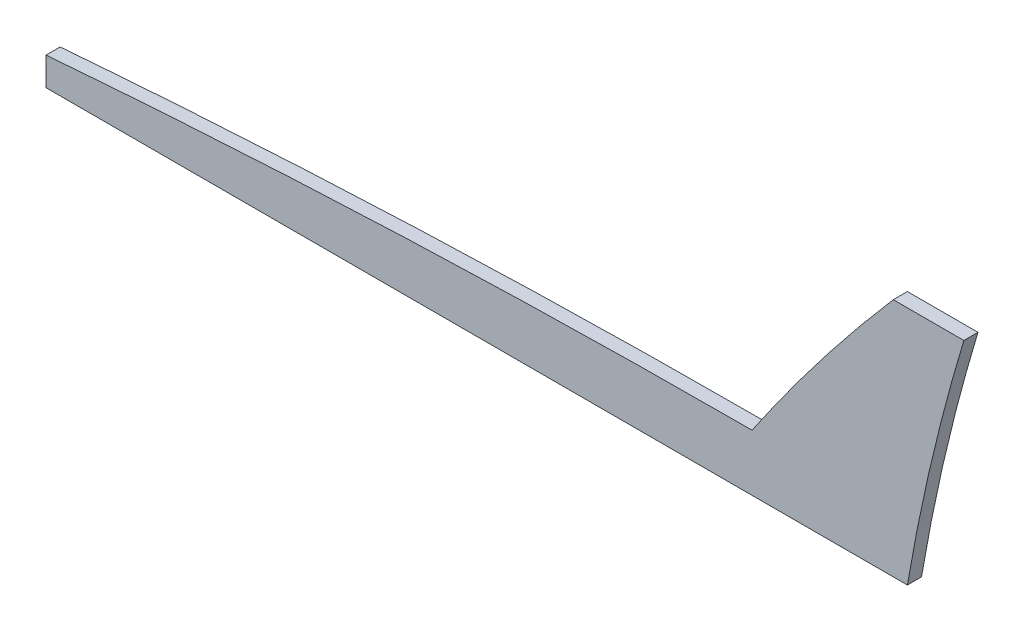
from build123d import *

# Parameters (mm, degrees)
BOSS_EXTRUDE1_DEPTH = 10


with BuildPart() as part:
    # Sketch1 → Boss-Extrude1 (new body)
    with BuildSketch(Plane.XY):
        with BuildLine():
            Line((0, 0), (0, -20))
            Line((0, -20), (610, -20))
            add(Edge.make_bspline(
                [(610, -20), (624.457520828, 65.560799572), (650, 150)],
                knots=[0, 0, 0, 1, 1, 1], degree=2))
            Line((650, 150), (600, 150))
            add(Edge.make_bspline(
                [(600, 150), (544.925349806, 86.324000125), (500, 20.000000001)],
                knots=[0, 0, 0, 1, 1, 1], degree=2))
            add(Edge.make_bspline(
                [(0, 0), (250, 20), (500, 20.000000001)],
                knots=[0.083156312, 0.083156312, 0.083156312, 0.916650574, 0.916650574, 0.916650574], degree=2))
        make_face()
    extrude(amount=BOSS_EXTRUDE1_DEPTH)


solid = part.part
